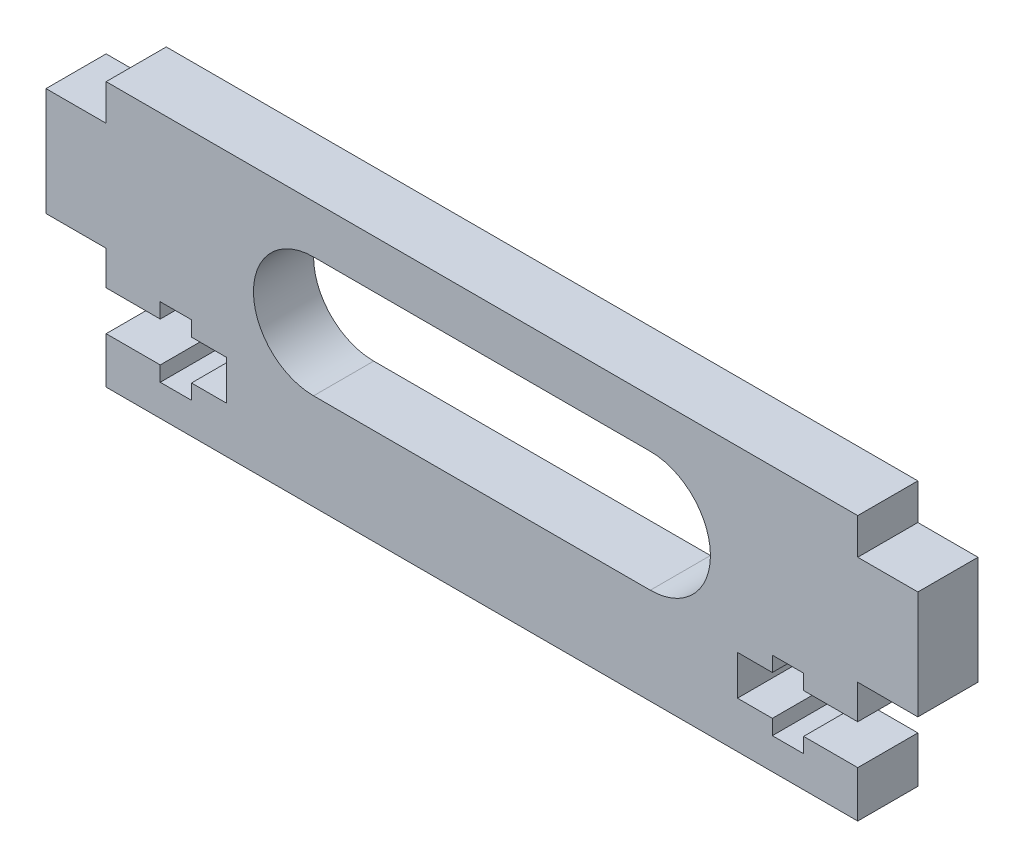
from build123d import *

# Parameters (mm, degrees)
PLASTINA_DEPTH = 5


with BuildPart() as part:
    # Eskiz_kontur → Plastina (new body)
    with BuildSketch(Plane.XY):
        Polygon((32.5, 12), (27.5, 12), (27.5, 9.15), (23, 9.15), (23, 10.4), (20.4, 10.4), (20.4, 9.15), (17.5, 9.15), (17.5, 5.85), (20.4, 5.85), (20.4, 4.6), (23, 4.6), (23, 5.85), (27.5, 5.85), (27.5, 2), (-35, 2), (-35, 5.85), (-30.5, 5.85), (-30.5, 4.6), (-27.9, 4.6), (-27.9, 5.85), (-25, 5.85), (-25, 9.15), (-27.9, 9.15), (-27.9, 10.4), (-30.5, 10.4), (-30.5, 9.15), (-35, 9.15), (-35, 12), (-40, 12), (-40, 21), (-35, 21), (-35, 24), (27.5, 24), (27.5, 21), (32.5, 21), align=None)
        with BuildLine():
            Line((10.25, 20), (-17.75, 20))
            ThreePointArc((-17.75, 20), (-22.75, 15), (-17.75, 10))
            Line((-17.75, 10), (10.25, 10))
            ThreePointArc((10.25, 10), (15.25, 15), (10.25, 20))
        make_face(mode=Mode.SUBTRACT)
    extrude(amount=PLASTINA_DEPTH)


solid = part.part
